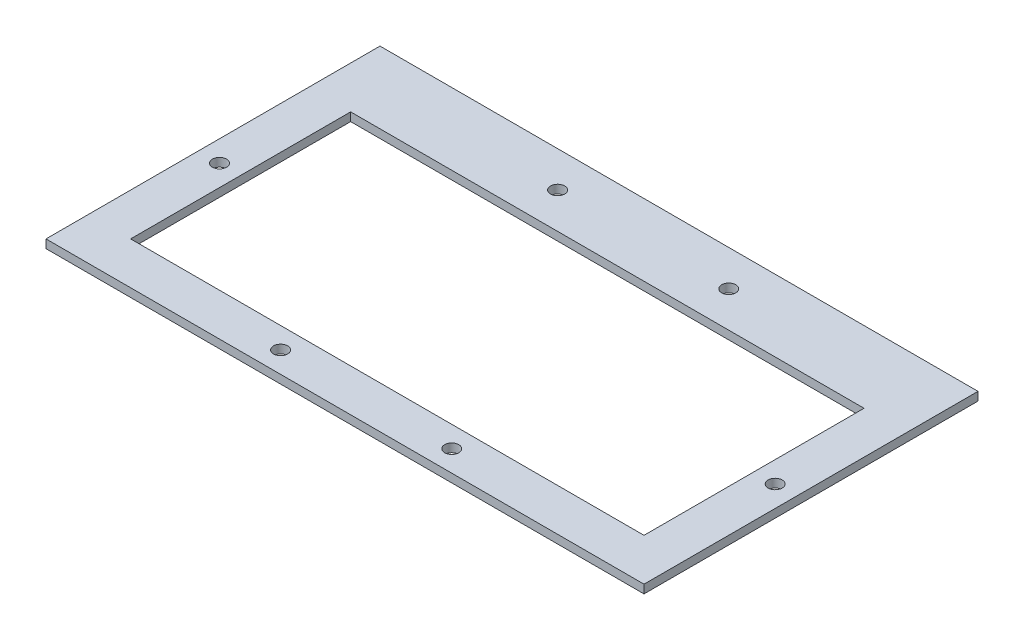
from build123d import *

# Parameters (mm, degrees)
SKETCH1_5_W         = 212
SKETCH1_5_H         = 118.4
SKETCH1_5_W_2       = 182
SKETCH1_5_H_2       = 78
SKETCH1_5_R         = 2.5
BOSS_EXTRUDE4_DEPTH = 3


with BuildPart() as part:
    # Sketch1<5> → Boss-Extrude4 (new body)
    with BuildSketch(Plane(origin=(0, 0, 0), x_dir=(1, 0, 0), z_dir=(0, 1, 0))):
        with Locations((106, -33.8)):
            Rectangle(SKETCH1_5_W, SKETCH1_5_H)
        with Locations((106, -39)):
            Rectangle(SKETCH1_5_W_2, SKETCH1_5_H_2, mode=Mode.SUBTRACT)
        with Locations((75.666666667, 12.7)):
            Circle(SKETCH1_5_R, mode=Mode.SUBTRACT)
        with Locations((136.333333333, 12.7)):
            Circle(SKETCH1_5_R, mode=Mode.SUBTRACT)
        with Locations((7.5, -39)):
            Circle(SKETCH1_5_R, mode=Mode.SUBTRACT)
        with Locations((204.5, -39)):
            Circle(SKETCH1_5_R, mode=Mode.SUBTRACT)
        with Locations((75.666666667, -85.5)):
            Circle(SKETCH1_5_R, mode=Mode.SUBTRACT)
        with Locations((136.333333333, -85.5)):
            Circle(SKETCH1_5_R, mode=Mode.SUBTRACT)
    extrude(amount=BOSS_EXTRUDE4_DEPTH)


solid = part.part
